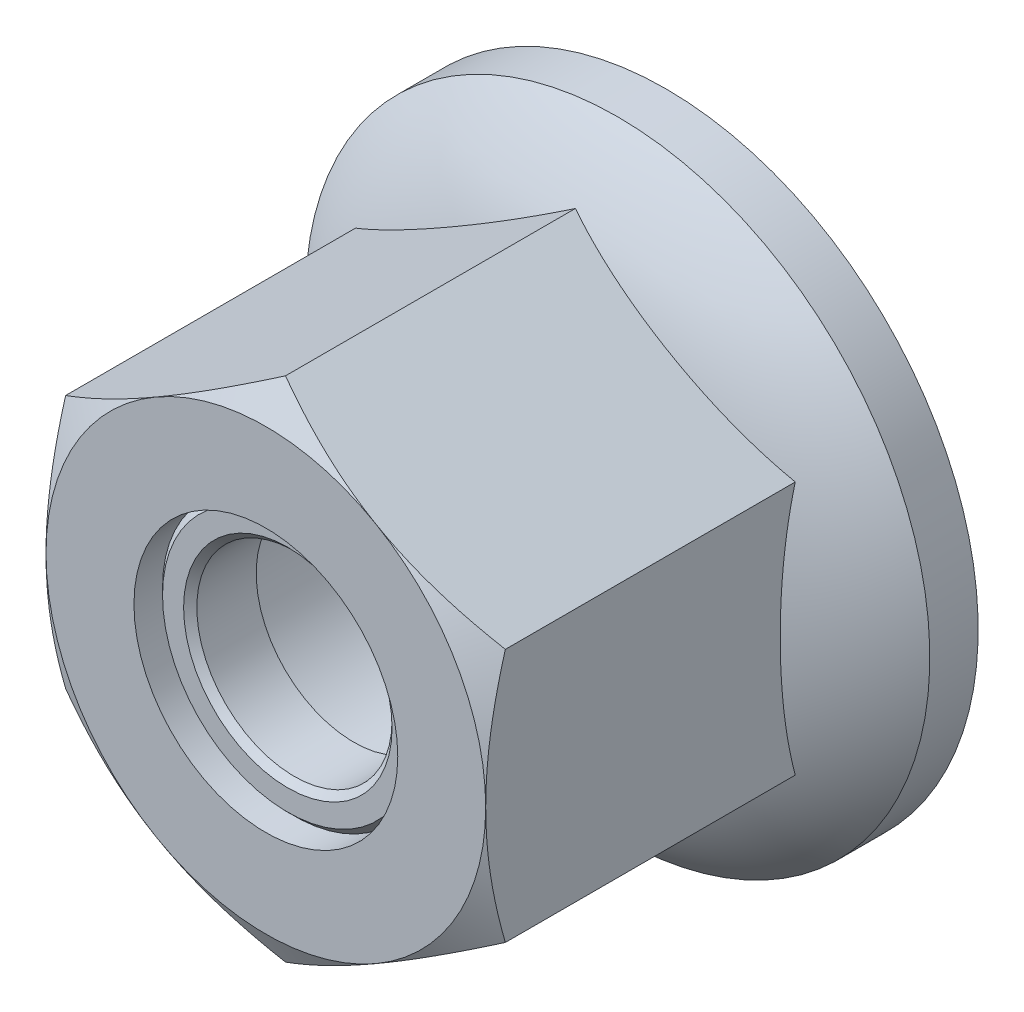
from build123d import *

# Parameters (mm, degrees)
SKETCH1_R           = 3
EXTRUDE1_DEPTH      = 9.1
SKETCH2_OUTSIDE_W   = 60.176
SKETCH2_OUTSIDE_H   = 61.724
SKETCH2_OUTSIDE_R   = 5
CUT_EXTRUDE1_DEPTH  = 12.880375976
CUT_EXTRUDE1_DRAFT  = -60
BOSS_EXTRUDE1_START = -0.5
SKETCH10_R          = 3
SKETCH10_R_2        = 2.220577137
BOSS_EXTRUDE1_DEPTH = 1.5
CHAMFER1_SIZE       = 0.15


with BuildPart() as part:
    # Sketch1 → Extrude1 (new body)
    with BuildSketch(Plane.XY):
        Polygon((0, 5.773502692), (-5, 2.886751346), (-5, -2.886751346), (0, -5.773502692), (5, -2.886751346), (5, 2.886751346), align=None)
        Circle(SKETCH1_R, mode=Mode.SUBTRACT)
    extrude(amount=-EXTRUDE1_DEPTH)


with BuildPart() as cut_extrude1_tool:
    # Sketch2 outside → Cut-Extrude1 (with draft: the straight prism first)
    with BuildSketch(Plane.XY):
        Rectangle(SKETCH2_OUTSIDE_W, SKETCH2_OUTSIDE_H)
        Circle(SKETCH2_OUTSIDE_R, mode=Mode.SUBTRACT)
    extrude(amount=-CUT_EXTRUDE1_DEPTH)
    # Cut-Extrude1: the draft: its side faces are tilted about the plane it starts from
    cut_extrude1_sides = [cut_extrude1_tool.faces().sort_by_distance(p)[0] for p in [
        (0, -30.862, -6.440187988),
        (30.088, 0, -6.440187988),
        (0, 30.862, -6.440187988),
        (-30.088, 0, -6.440187988),
        (-5, 0, -6.440187988),
    ]]
    draft(cut_extrude1_sides, Plane.XY, CUT_EXTRUDE1_DRAFT)


with BuildPart() as part_1:
    add(part.part)

    # Cut-Extrude1: cut by cut_extrude1_tool
    add(cut_extrude1_tool.part, mode=Mode.SUBTRACT)

    # Sketch3 → Revolve1 (revolve)
    with BuildSketch(Plane(origin=(0, 0, 0), x_dir=(0, 0, -1), z_dir=(1, 0, 0))):
        with BuildLine():
            Line((9.1, 7.1), (9.1, 3))
            Line((9.1, 3), (6.35, 3))
            ThreePointArc((6.35, 3), (6.777972398, 5.209779401), (8, 7.1))
            Line((8, 7.1), (9.1, 7.1))
        make_face()
    revolve(axis=Axis((0, 0, 0), (0, 0, -1)))


with BuildPart() as body_2:
    # Sketch10 → Boss-Extrude1 (new body)
    with BuildSketch(Plane.XY.offset(BOSS_EXTRUDE1_START)):
        Circle(SKETCH10_R)
        Circle(SKETCH10_R_2, mode=Mode.SUBTRACT)
    extrude(amount=-BOSS_EXTRUDE1_DEPTH)

    # Chamfer1
    chamfer1_edges = [body_2.edges().sort_by_distance(p)[0] for p in [
        (-3, 0, -0.5),
        (-2.220577137, 0, -0.5),
    ]]
    chamfer(chamfer1_edges, length=CHAMFER1_SIZE)


solid = Compound([part_1.part, body_2.part])
